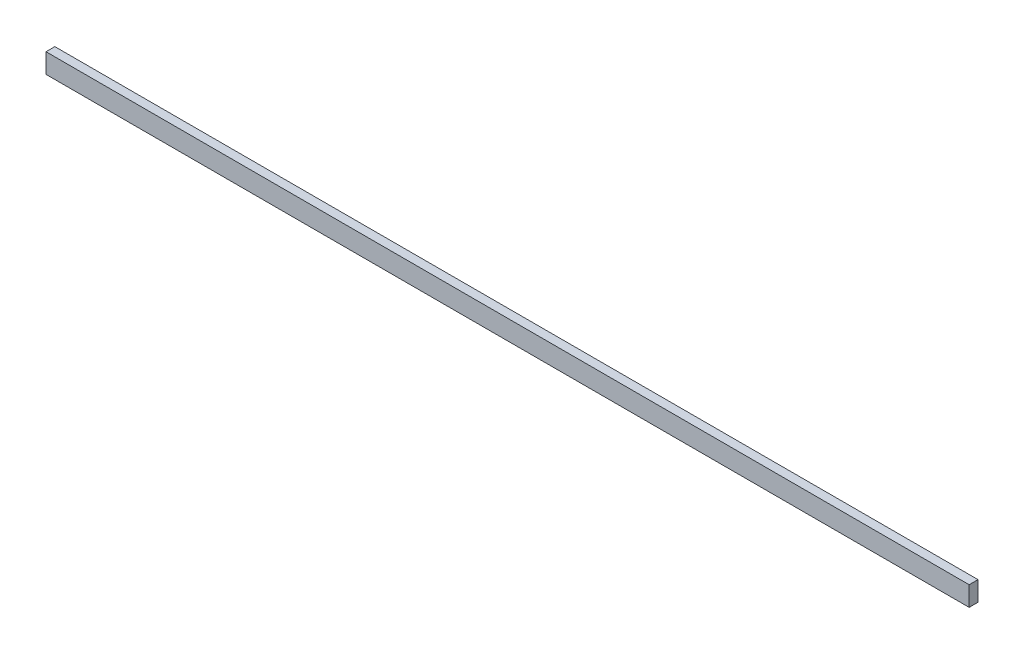
from build123d import *

# Parameters (mm, degrees)
BOSS_EXTRUDE1_DEPTH      = 10
BOSS_EXTRUDE1_DEPTH_BACK = 8
SKETCH1_W                = 1880
SKETCH1_H                = 40


with BuildPart() as part:
    # Sketch1 → Boss-Extrude1 (new, two sides: drawn at the far end of the back side and taken through both)
    with BuildSketch(Plane.XY.offset(-BOSS_EXTRUDE1_DEPTH_BACK)):
        Rectangle(SKETCH1_W, SKETCH1_H)
    extrude(amount=BOSS_EXTRUDE1_DEPTH + BOSS_EXTRUDE1_DEPTH_BACK)


solid = part.part
